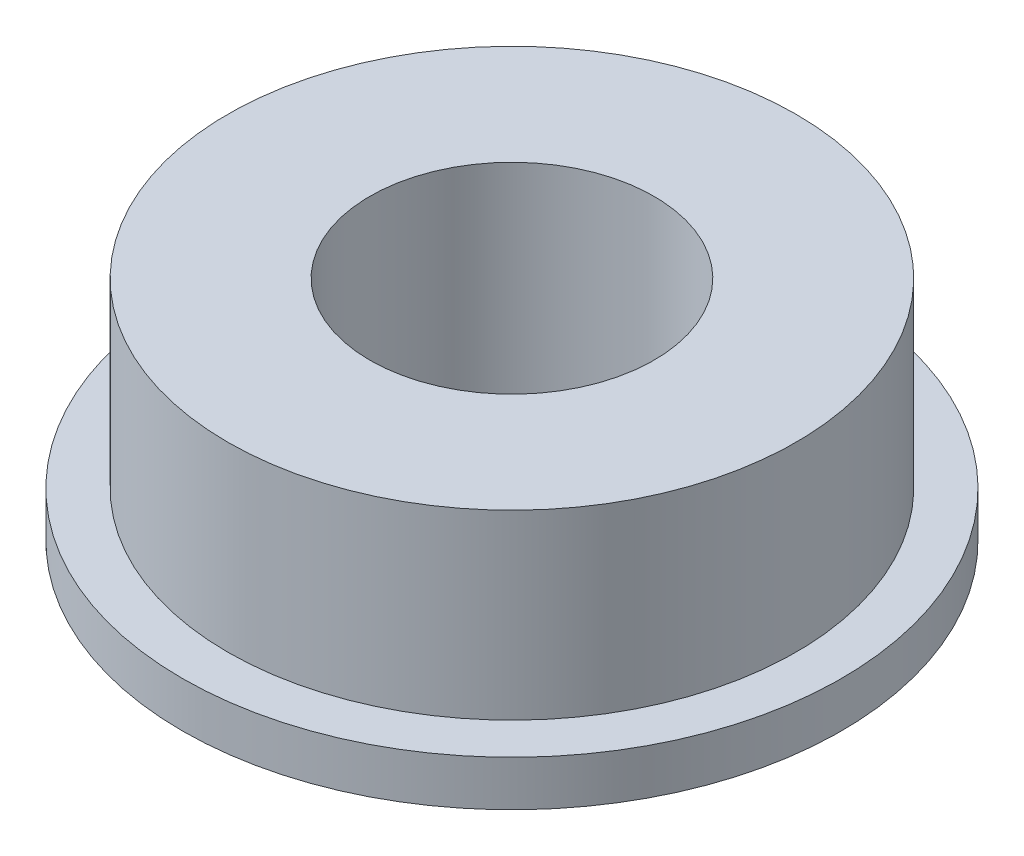
from build123d import *

# Parameters (mm, degrees)
SKETCH_1_R      = 5.8
EXTRUDE_1_DEPTH = 0.8
SKETCH_2_R      = 5
EXTRUDE_2_DEPTH = 3.2
HOLE_WIZARD_1_D = 5


with BuildPart() as part:
    # 草图1 → 凸台-拉伸1 (new body)
    with BuildSketch(Plane(origin=(0, 0, 0), x_dir=(1, 0, 0), z_dir=(0, 1, 0))):
        with Locations(Location((0, 0, 0), (0, 0, 270))):
            Circle(SKETCH_1_R)
    extrude(amount=EXTRUDE_1_DEPTH)

    # 草图2 → 凸台-拉伸2 (add)
    with BuildSketch(Plane(origin=(0, 0.8, 0), x_dir=(1, 0, 0), z_dir=(0, 1, 0))):
        with Locations(Location((0, 0, 0), (0, 0, 270))):
            Circle(SKETCH_2_R)
    extrude(amount=EXTRUDE_2_DEPTH)

    # 孔1 (through all)
    with Locations(Plane(origin=(0, 4, 0), x_dir=(1, 0, 0), z_dir=(0, 1, 0))):
        with Locations((0, 0)):
            Hole(HOLE_WIZARD_1_D / 2)


solid = part.part
